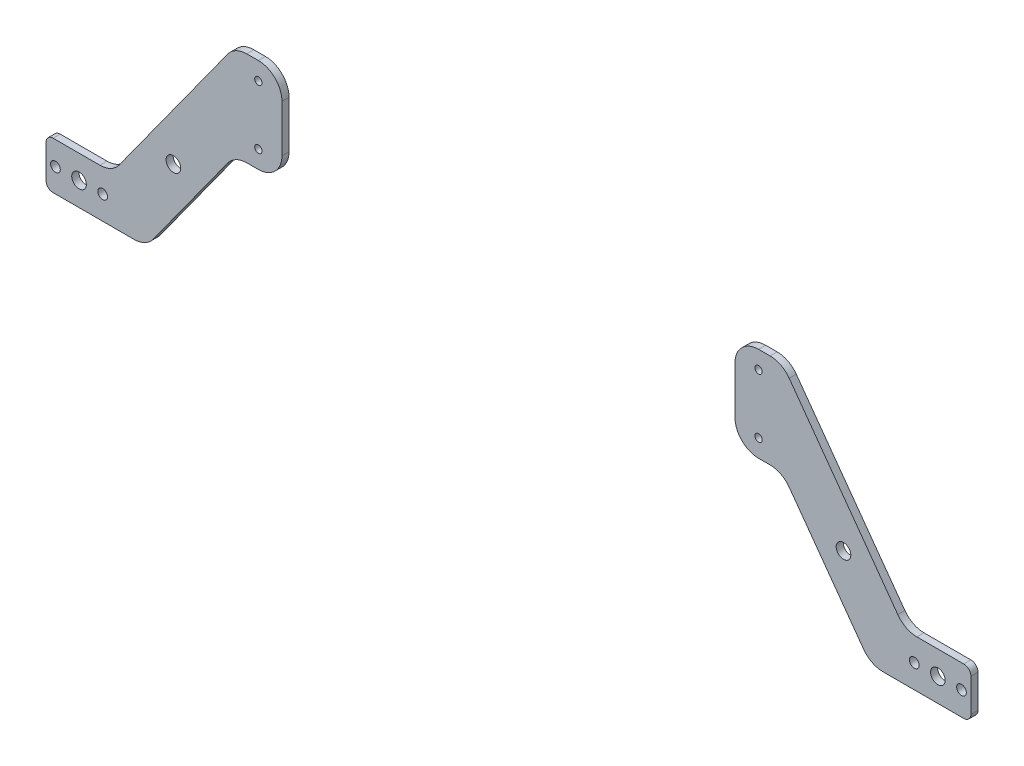
from build123d import *

# Parameters (mm, degrees)
SKETCH_1_W          = 232
SKETCH_1_H          = 40
SKETCH_1_R          = 2.1
EXTRUDE_1_DEPTH     = 3
SKETCH_2_R          = 3.1
EXTRUDE_2_DEPTH     = 3
SKETCH_4_R          = 1.55
CUT_EXTRUDE_2_DEPTH = 10
FILLET_1_R          = 3
FILLET_2_R          = 10
SKETCH_5_W          = 192
SKETCH_5_H          = 40
CUT_EXTRUDE_3_DEPTH = 5
FILLET_3_R          = 10
FILLET_4_R          = 10
SKETCH_6_R          = 2.05
SKETCH_6_R_2        = 3.1
CUT_EXTRUDE_4_DEPTH = 209.827680158


with BuildPart() as part:
    # 草图1 → 凸台-拉伸1 (new body)
    with BuildSketch(Plane.XY):
        Rectangle(SKETCH_1_W, SKETCH_1_H)
        with Locations((-47.5, 12.5)):
            Circle(SKETCH_1_R, mode=Mode.SUBTRACT)
        with Locations((47.5, 12.5)):
            Circle(SKETCH_1_R, mode=Mode.SUBTRACT)
        with Locations((-47.5, -12.5)):
            Circle(SKETCH_1_R, mode=Mode.SUBTRACT)
        with Locations((47.5, -12.5)):
            Circle(SKETCH_1_R, mode=Mode.SUBTRACT)
    extrude(amount=EXTRUDE_1_DEPTH)

    # 草图2 → 凸台-拉伸2 (add)
    # profile 1 of 2: a face of its own
    with BuildSketch(Plane.XY.offset(3)):
        Polygon((-116, 20), (-168, -52), (-196, -52), (-196, -72), (-153.555555556, -72), (-116, -20), align=None)
        with Locations((-142, -36)):
            Circle(SKETCH_2_R, mode=Mode.SUBTRACT)
    # profile 2 of 2: a face of its own
    with BuildSketch(Plane.XY.offset(3)):
        Polygon((116, 20), (168, -52), (196, -52), (196, -72), (153.555555556, -72), (116, -20), align=None)
        with Locations(Location((142, -36, 0), (0, 0, 180))):
            Circle(SKETCH_2_R, mode=Mode.SUBTRACT)
    extrude(amount=-EXTRUDE_2_DEPTH)

    # 草图4 → 切除-拉伸2 (cut)
    with BuildSketch(Plane.XY.offset(3)):
        with Locations((-106, 12.5)):
            Circle(SKETCH_4_R)
        with Locations((-106, -12.5)):
            Circle(SKETCH_4_R)
        with Locations((106, 12.5)):
            Circle(SKETCH_4_R)
        with Locations((106, -12.5)):
            Circle(SKETCH_4_R)
    extrude(amount=-CUT_EXTRUDE_2_DEPTH, mode=Mode.SUBTRACT)

    # 圆角1
    fillet_1_edges = [part.edges().sort_by_distance(p)[0] for p in [
        (-196, -72, 1.5),
        (-196, -52, 1.5),
        (196, -52, 1.5),
        (196, -72, 1.5),
    ]]
    fillet(fillet_1_edges, radius=FILLET_1_R)

    # 圆角2
    fillet_2_edges = [part.edges().sort_by_distance(p)[0] for p in [
        (-153.555555556, -72, 1.5),
        (-168, -52, 1.5),
        (168, -52, 1.5),
        (153.555555556, -72, 1.5),
        (116, -20, 1.5),
        (-116, -20, 1.5),
        (-116, 20, 1.5),
        (116, 20, 1.5),
    ]]
    fillet(fillet_2_edges, radius=FILLET_2_R)

    # 草图5 → 切除-拉伸3 (cut, symmetric)
    with BuildSketch(Plane.XY.offset(3)):
        Rectangle(SKETCH_5_W, SKETCH_5_H)
    extrude(amount=CUT_EXTRUDE_3_DEPTH, both=True, mode=Mode.SUBTRACT)


with BuildPart() as cut_extrude_3_piece_1:
    # of the separate pieces the step leaves, piece 1, a body of its own (cut_extrude_3_pieces)
    add(part.part.solids().sort_by_distance((96, 20, 0))[0])

    # 圆角4
    fillet_4_edges = [cut_extrude_3_piece_1.edges().sort_by_distance(p)[0] for p in [
        (96, -20, 1.5),
        (96, 20, 1.5),
    ]]
    fillet(fillet_4_edges, radius=FILLET_4_R)


with BuildPart() as cut_extrude_3_piece_2:
    # of the separate pieces the step leaves, piece 2, a body of its own (cut_extrude_3_pieces)
    add(part.part.solids().sort_by_distance((-158.668668506, -72, 0))[0])

    # 圆角3
    fillet_3_edges = [cut_extrude_3_piece_2.edges().sort_by_distance(p)[0] for p in [
        (-96, -20, 1.5),
        (-96, 20, 1.5),
    ]]
    fillet(fillet_3_edges, radius=FILLET_3_R)


with BuildPart() as cut_extrude_4_tool:
    # 草图6 → 切除-拉伸4 (new, through all)
    with BuildSketch(Plane.XY.offset(3)):
        with Locations((-192, -62)):
            Circle(SKETCH_6_R)
        with Locations((-172, -62)):
            Circle(SKETCH_6_R)
        with Locations(Location((172, -62, 0), (0, 0, 180))):
            Circle(SKETCH_6_R)
        with Locations(Location((192, -62, 0), (0, 0, 180))):
            Circle(SKETCH_6_R)
        with Locations((-182, -62)):
            Circle(SKETCH_6_R_2)
        with Locations((182, -62)):
            Circle(SKETCH_6_R_2)
    extrude(amount=-CUT_EXTRUDE_4_DEPTH)


with BuildPart() as cut_extrude_3_piece_1_1:
    add(cut_extrude_3_piece_1.part)

    # 切除-拉伸4: cut by cut_extrude_4_tool
    add(cut_extrude_4_tool.part, mode=Mode.SUBTRACT)


with BuildPart() as cut_extrude_3_piece_2_1:
    add(cut_extrude_3_piece_2.part)

    # 切除-拉伸4: cut by cut_extrude_4_tool
    add(cut_extrude_4_tool.part, mode=Mode.SUBTRACT)


solid = Compound([cut_extrude_3_piece_1_1.part, cut_extrude_3_piece_2_1.part])
